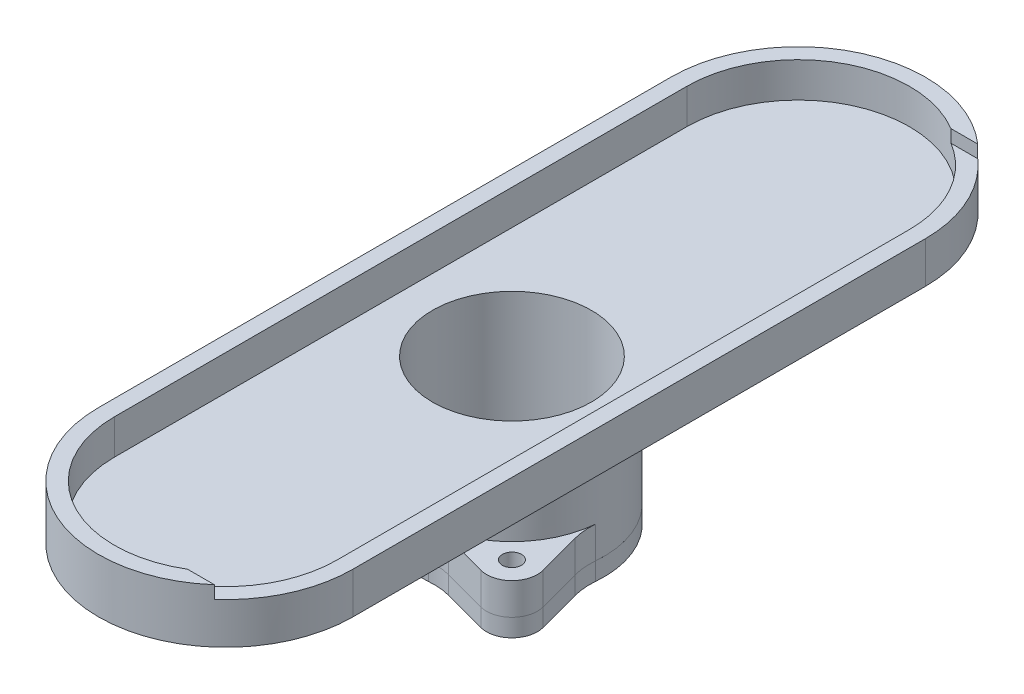
from build123d import *
from build123d.topology import SkipClean

# Parameters (mm, degrees)
SKETCH_1_R          = 12.5
SKETCH_1_R_2        = 1.5
EXTRUDE_1_DEPTH     = 5
SKETCH_2_R          = 12.5
EXTRUDE_2_DEPTH     = 15
EXTRUDE_9_DEPTH     = 5.5
EXTRUDE_START       = 2.8
SKETCH_12_R         = 12.5
SKETCH_12_R_2       = 1.5
EXTRUDE_8_DEPTH     = 2.8
EXTRUDE_START_2     = 3
SKETCH_15_R         = 14.5
EXTRUDE_10_DEPTH    = 3
SKETCH_16_W         = 120
SKETCH_16_H         = 2
CUT_EXTRUDE_1_DEPTH = 16


with BuildPart() as part:
    # 草圖1 → 填料-伸長1 (new body)
    with BuildSketch(Plane(origin=(0, 5.156954032, 0), x_dir=(1, 0, 0), z_dir=(0, 1, 0))):
        with BuildLine():
            ThreePointArc((-44.792972571, -181.302345222), (-44.796491977, -183.058763578), (-44.492647899, -184.788704792))
            Line((-44.492647899, -184.788704792), (-42.64274246, -191.692645881))
            ThreePointArc((-42.64274246, -191.692645881), (-43.67801864, -195.556349186), (-47.541721945, -196.591625367))
            Line((-47.541721945, -196.591625367), (-54.445663034, -194.741719927))
            ThreePointArc((-54.445663034, -194.741719927), (-56.175604248, -194.43787585), (-57.932022604, -194.441395255))
            ThreePointArc((-57.932022604, -194.441395255), (-69.487416154, -190.253048327), (-73.675763082, -178.697654778))
            ThreePointArc((-73.675763082, -178.697654778), (-73.672243676, -176.941236422), (-73.976087754, -175.211295208))
            Line((-73.976087754, -175.211295208), (-75.825993193, -168.307354119))
            ThreePointArc((-75.825993193, -168.307354119), (-74.790717013, -164.443650814), (-70.927013707, -163.408374633))
            Line((-70.927013707, -163.408374633), (-64.023072619, -165.258280073))
            ThreePointArc((-64.023072619, -165.258280073), (-62.293131405, -165.56212415), (-60.536713049, -165.558604745))
            ThreePointArc((-60.536713049, -165.558604745), (-48.981319499, -169.746951673), (-44.792972571, -181.302345222))
        make_face()
        with Locations(Location((-59.234367826, -180, 0), (0, 0, 270))):
            Circle(SKETCH_1_R, mode=Mode.SUBTRACT)
        with Locations(Location((-71.962289888, -167.272077939, 0), (0, 0, 270))):
            Circle(SKETCH_1_R_2, mode=Mode.SUBTRACT)
        with Locations(Location((-46.506445765, -192.727922061, 0), (0, 0, 270))):
            Circle(SKETCH_1_R_2, mode=Mode.SUBTRACT)
    extrude(amount=EXTRUDE_1_DEPTH)

    # 草圖2 → 填料-伸長2 (add)
    with SkipClean():  # the faces are left unmerged after this step: merging them gives an invalid solid
        with BuildSketch(Plane(origin=(0, 10.156954032, 0), x_dir=(1, 0, 0), z_dir=(0, 1, 0))):
            with BuildLine():
                ThreePointArc((-57.932022604, -194.441395255), (-57.58271092, -194.405624924), (-57.234367826, -194.361406616))
                ThreePointArc((-57.234367826, -194.361406616), (-48.736051742, -190.001767813), (-44.792972571, -181.302345222))
                ThreePointArc((-44.792972571, -181.302345222), (-44.749026422, -180.651831572), (-44.734367826, -180))
                ThreePointArc((-44.734367826, -180), (-48.297046399, -170.480283618), (-57.234367826, -165.638593384))
                ThreePointArc((-57.234367826, -165.638593384), (-58.883255177, -165.504251661), (-60.536713049, -165.558604745))
                ThreePointArc((-60.536713049, -165.558604745), (-69.487416154, -169.746951673), (-73.675763082, -178.697654778))
                ThreePointArc((-73.675763082, -178.697654778), (-69.487416154, -190.253048327), (-57.932022604, -194.441395255))
            make_face()
            with Locations(Location((-59.234367826, -180, 0), (0, 0, 270))):
                Circle(SKETCH_2_R, mode=Mode.SUBTRACT)
        extrude(amount=EXTRUDE_2_DEPTH)



with BuildPart() as body_2:
    # 草圖13 → 填料-伸長9 (new body)
    with BuildSketch(Plane(origin=(0, 25.156954032, 0), x_dir=(1, 0, 0), z_dir=(0, 1, 0))):
        with BuildLine():
            Line((-79.234367826, -225), (-79.234367826, -135))
            ThreePointArc((-79.234367826, -135), (-59.234367826, -115), (-39.234367826, -135))
            Line((-39.234367826, -135), (-39.234367826, -225))
            ThreePointArc((-39.234367826, -225), (-59.234367826, -245), (-79.234367826, -225))
        make_face()
        with BuildLine():
            Line((-76.734367826, -225), (-76.734367826, -135))
            ThreePointArc((-76.734367826, -135), (-59.234367826, -117.5), (-41.734367826, -135))
            Line((-41.734367826, -135), (-41.734367826, -225))
            ThreePointArc((-41.734367826, -225), (-59.234367826, -242.5), (-76.734367826, -225))
        make_face(mode=Mode.SUBTRACT)
    extrude(amount=EXTRUDE_9_DEPTH)


with BuildPart() as body_3:
    # 草圖12 → 填料-伸長8 (new body)
    with BuildSketch(Plane.XZ.offset(-5.156954032).offset(EXTRUDE_START)):
        with BuildLine():
            Line((-44.492647899, 184.788704792), (-42.64274246, 191.692645881))
            ThreePointArc((-42.64274246, 191.692645881), (-43.67801864, 195.556349186), (-47.541721945, 196.591625367))
            Line((-47.541721945, 196.591625367), (-54.445663034, 194.741719927))
            ThreePointArc((-54.445663034, 194.741719927), (-56.175604248, 194.43787585), (-57.932022604, 194.441395255))
            ThreePointArc((-57.932022604, 194.441395255), (-69.487416154, 190.253048327), (-73.675763082, 178.697654778))
            ThreePointArc((-73.675763082, 178.697654778), (-73.672243676, 176.941236422), (-73.976087754, 175.211295208))
            Line((-73.976087754, 175.211295208), (-75.825993193, 168.307354119))
            ThreePointArc((-75.825993193, 168.307354119), (-74.790717013, 164.443650814), (-70.927013707, 163.408374633))
            Line((-70.927013707, 163.408374633), (-64.023072619, 165.258280073))
            ThreePointArc((-64.023072619, 165.258280073), (-62.293131405, 165.56212415), (-60.536713049, 165.558604745))
            ThreePointArc((-60.536713049, 165.558604745), (-48.981319499, 169.746951673), (-44.792972571, 181.302345222))
            ThreePointArc((-44.792972571, 181.302345222), (-44.796491977, 183.058763578), (-44.492647899, 184.788704792))
        make_face()
        with Locations(Location((-59.234367826, 180, 0), (0, 0, 270))):
            Circle(SKETCH_12_R, mode=Mode.SUBTRACT)
        with Locations(Location((-71.962289888, 167.272077939, 0), (0, 0, 270))):
            Circle(SKETCH_12_R_2, mode=Mode.SUBTRACT)
        with Locations(Location((-46.506445765, 192.727922061, 0), (0, 0, 270))):
            Circle(SKETCH_12_R_2, mode=Mode.SUBTRACT)
    extrude(amount=-EXTRUDE_8_DEPTH)


with BuildPart() as part_1:
    with SkipClean():  # the faces are left unmerged after this step: merging them gives an invalid solid
        add(part.part)

        add(body_2.part)  # 填料-伸長10 merges body 2
        # 草圖15 → 填料-伸長10 (add)
        with BuildSketch(Plane.XZ.offset(-25.156954032).offset(EXTRUDE_START_2)):
            with BuildLine():
                Line((-79.234367826, 225), (-79.234367826, 135))
                ThreePointArc((-79.234367826, 135), (-59.234367826, 115), (-39.234367826, 135))
                Line((-39.234367826, 135), (-39.234367826, 225))
                ThreePointArc((-39.234367826, 225), (-59.234367826, 245), (-79.234367826, 225))
            make_face()
            with Locations(Location((-59.234367826, 180, 0), (0, 0, 270))):
                Circle(SKETCH_15_R, mode=Mode.SUBTRACT)
        extrude(amount=-EXTRUDE_10_DEPTH)

    # 草圖16 → 除料-伸長1 (cut)
    with SkipClean():  # the faces are left unmerged after this step: merging them gives an invalid solid
        with BuildSketch(Plane(origin=(-39.234367826, 0, 0), x_dir=(0, 0, -1), z_dir=(1, 0, 0))):
            with Locations((-180, 29.656954032)):
                Rectangle(SKETCH_16_W, SKETCH_16_H)
        extrude(amount=-CUT_EXTRUDE_1_DEPTH, mode=Mode.SUBTRACT)


solid = Compound([body_3.part, part_1.part])
